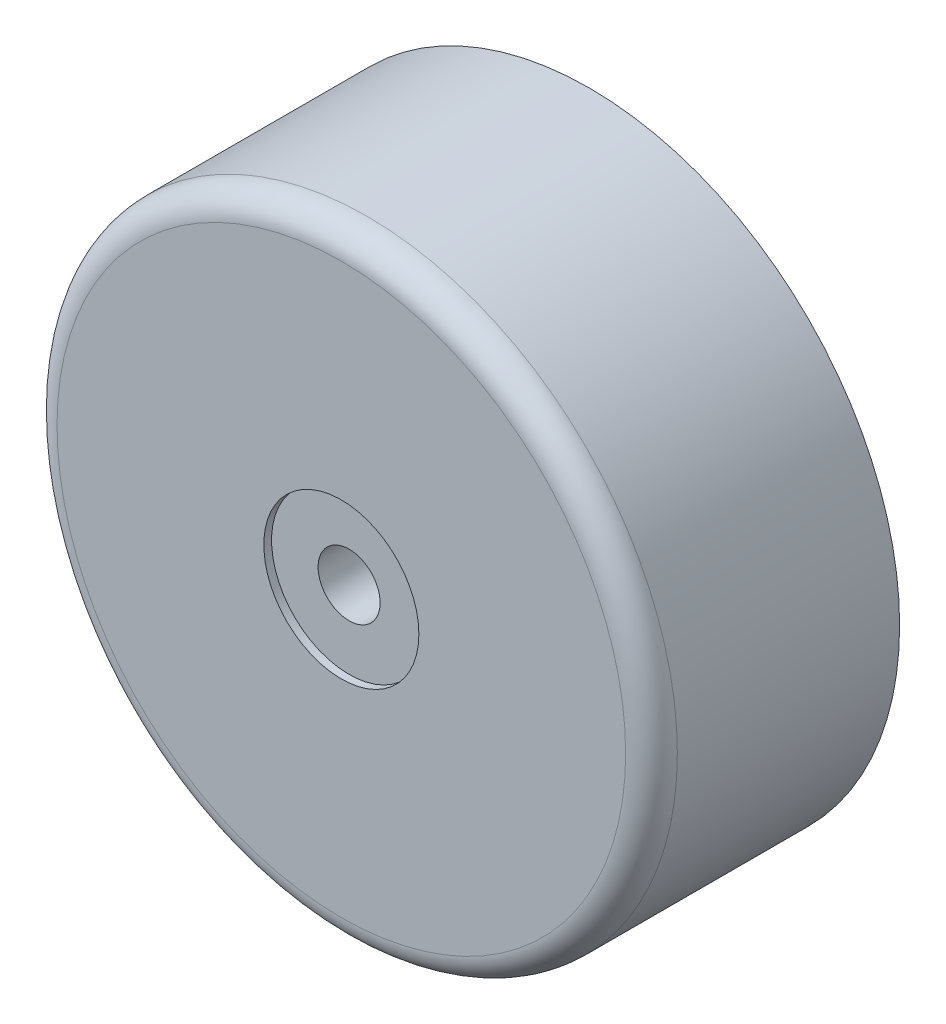
from build123d import *

# Parameters (mm, degrees)
ESBO_O1_R                = 12
RESSALTO_EXTRUS_O1_DEPTH = 9.6
ESBO_O2_R                = 11.4
CORTE_EXTRUS_O1_DEPTH    = 0.1
ESBO_O3_R                = 0.5
RESSALTO_EXTRUS_O2_DEPTH = 2
ESBO_O4_R                = 1.2
CORTE_EXTRUS_O2_DEPTH    = 2
ESBO_O5_R                = 3
CORTE_EXTRUS_O3_DEPTH    = 0.3
FILETE1_R                = 1


with BuildPart() as part:
    # Esboço1 → Ressalto-extrusão1 (new body)
    with BuildSketch(Plane.XY):
        Circle(ESBO_O1_R)
    extrude(amount=RESSALTO_EXTRUS_O1_DEPTH)

    # Esboço2 → Corte-extrusão1 (cut)
    with BuildSketch(Plane(origin=(0, 0, 0), x_dir=(-1, 0, 0), z_dir=(0, 0, -1))):
        Circle(ESBO_O2_R)
    extrude(amount=-CORTE_EXTRUS_O1_DEPTH, mode=Mode.SUBTRACT)

    # Esboço3 → Ressalto-extrusão2 (add)
    with BuildSketch(Plane(origin=(0, 0, 0.1), x_dir=(-1, 0, 0), z_dir=(0, 0, -1))):
        with Locations((6, 0)):
            Circle(ESBO_O3_R)
        with Locations((-6, 0)):
            Circle(ESBO_O3_R)
    extrude(amount=RESSALTO_EXTRUS_O2_DEPTH)

    # Esboço4 → Corte-extrusão2 (cut)
    with BuildSketch(Plane.XY.offset(9.6)):
        Circle(ESBO_O4_R)
    extrude(amount=-CORTE_EXTRUS_O2_DEPTH, mode=Mode.SUBTRACT)

    # Esboço5 → Corte-extrusão3 (cut)
    with BuildSketch(Plane.XY.offset(9.6)):
        Circle(ESBO_O5_R)
    extrude(amount=-CORTE_EXTRUS_O3_DEPTH, mode=Mode.SUBTRACT)

    # Filete1
    filete1_edges = [part.edges().sort_by_distance(p)[0] for p in [
        (-12, 0, 9.6),
    ]]
    fillet(filete1_edges, radius=FILETE1_R)


solid = part.part
